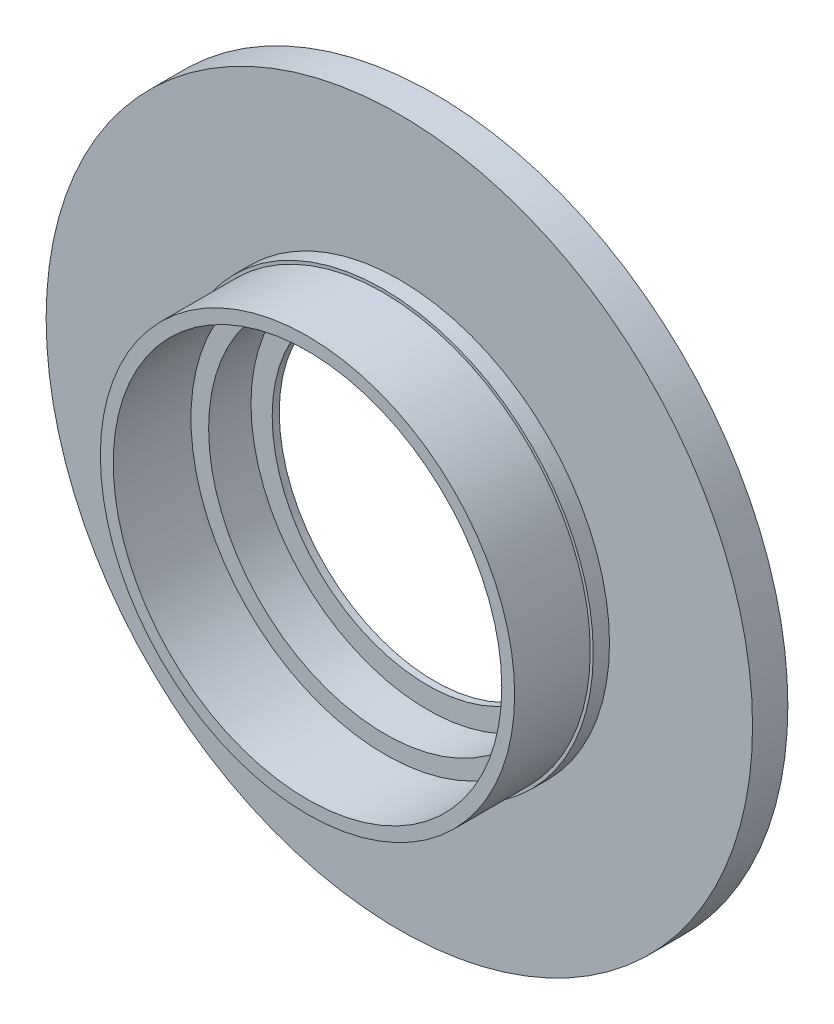
from build123d import *

# Parameters (mm, degrees)
SKETCH1_R           = 50
SKETCH1_R_2         = 22
BOSS_EXTRUDE1_DEPTH = 5
SKETCH1_3_R         = 29.325
SKETCH1_3_R_2       = 27.5
BOSS_EXTRUDE2_DEPTH = 18
SKETCH2_R           = 29.75
SKETCH2_R_2         = 29.325
BOSS_EXTRUDE3_DEPTH = 2.3
SKETCH3_R           = 27.5
SKETCH3_R_2         = 25
BOSS_EXTRUDE4_DEPTH = 2
CUT_EXTRUDE1_START  = -4
SKETCH4_R           = 25
SKETCH4_R_2         = 22
CUT_EXTRUDE1_DEPTH  = 4


with BuildPart() as part:
    # Sketch1 → Boss-Extrude1 (new body)
    with BuildSketch(Plane.XY):
        Circle(SKETCH1_R)
        Circle(SKETCH1_R_2, mode=Mode.SUBTRACT)
    extrude(amount=BOSS_EXTRUDE1_DEPTH)

    # Sketch1<3> → Boss-Extrude2 (add)
    with BuildSketch(Plane.XY):
        Circle(SKETCH1_3_R)
        Circle(SKETCH1_3_R_2, mode=Mode.SUBTRACT)
    extrude(amount=BOSS_EXTRUDE2_DEPTH)

    # Sketch2 → Boss-Extrude3 (add)
    with BuildSketch(Plane.XY.offset(5)):
        Circle(SKETCH2_R)
        Circle(SKETCH2_R_2, mode=Mode.SUBTRACT)
    extrude(amount=BOSS_EXTRUDE3_DEPTH)

    # Sketch3 → Boss-Extrude4 (add)
    with BuildSketch(Plane.XY.offset(5)):
        Circle(SKETCH3_R)
        Circle(SKETCH3_R_2, mode=Mode.SUBTRACT)
    extrude(amount=BOSS_EXTRUDE4_DEPTH)

    # Sketch4 → Cut-Extrude1 (cut)
    with BuildSketch(Plane.XY.offset(5).offset(CUT_EXTRUDE1_START)):
        Circle(SKETCH4_R)
        Circle(SKETCH4_R_2, mode=Mode.SUBTRACT)
    extrude(amount=CUT_EXTRUDE1_DEPTH, mode=Mode.SUBTRACT)


solid = part.part
